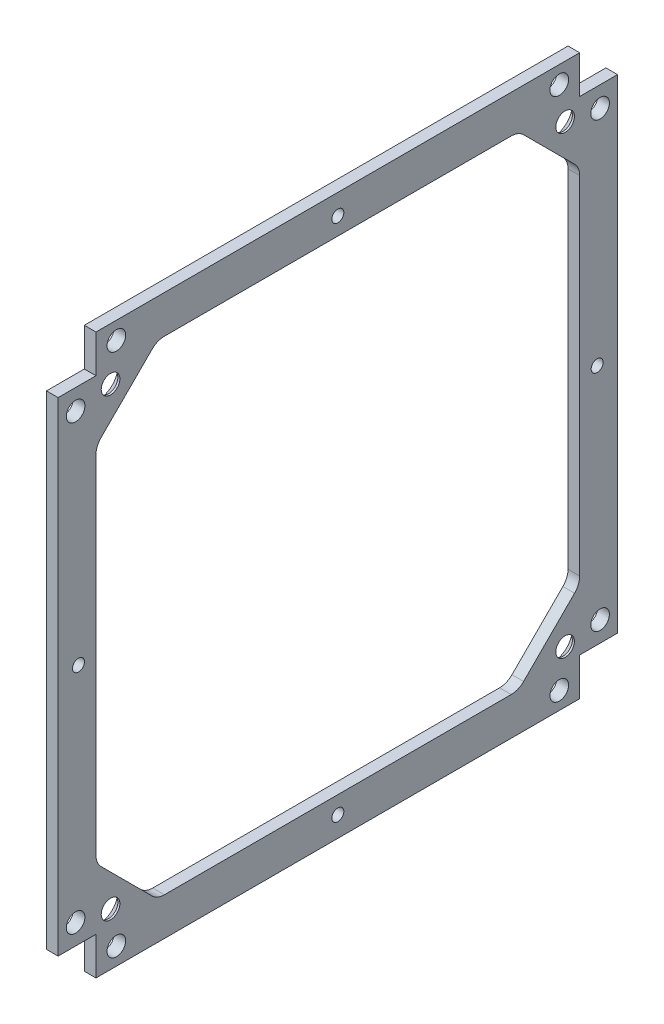
from build123d import *

# Parameters (mm, degrees)
BOSS_EXTRUDE2_DEPTH                          = 2
F_3_2_3_2_DIAMETER_HOLE1_D                   = 3.2
F_3_2_3_2_DIAMETER_HOLE2_D                   = 3.2
F_3_2_3_2_DIAMETER_HOLE3_D                   = 3.2
F_3_2_3_2_DIAMETER_HOLE5_D                   = 3.2
F_3_2_3_2_DIAMETER_HOLE5_DEPTH               = 10
F_3_2_3_2_DIAMETER_HOLE5_TIP                 = 0.96137699
CSK_FOR_M3_FLAT_COUNTERSUNK_HEAD_SCR_2_COUNT = 2
CSK_FOR_M3_FLAT_COUNTERSUNK_HEAD_SCR_2_PITCH = 78
CSK_FOR_M3_FLAT_COUNTERSUNK_HEAD_SCR_3_COUNT = 2
CSK_FOR_M3_FLAT_COUNTERSUNK_HEAD_SCR_3_PITCH = 110.308657865
FILLET1_R                                    = 3
M2_5X0_45_TAPPED_HOLE1_D                     = 2.05


with BuildPart() as part:
    # Sketch2 → Boss-Extrude2 (new body)
    with BuildSketch(Plane.ZY.offset(51.493641502)):
        Polygon((0.93465612, 3.45185693), (7.43465612, 3.45185693), (7.43465612, 86.45185693), (0.93465612, 86.45185693), (0.93465612, 92.95185693), (-82.06534388, 92.95185693), (-82.06534388, 86.45185693), (-88.56534388, 86.45185693), (-88.56534388, 3.45185693), (-82.06534388, 3.45185693), (-82.06534388, -3.04814307), (0.93465612, -3.04814307), align=None)
        Polygon((-71.56534388, 86.45185693), (-82.06534388, 75.95185693), (-82.06534388, 13.95185693), (-71.56534388, 3.45185693), (-9.56534388, 3.45185693), (0.93465612, 13.95185693), (0.93465612, 75.95185693), (-9.56534388, 86.45185693), align=None, mode=Mode.SUBTRACT)
    extrude(amount=BOSS_EXTRUDE2_DEPTH)

    # Sketch10 → CSK for M3 Flat Countersunk Head Screw3 (revolve, cut)
    with BuildSketch(Plane(origin=(-53.493641502, 5.95185693, -1.56534388), x_dir=(0, 0, 1), z_dir=(0, 1, 0))):
        Polygon((0, 0), (0, 2), (1.6, 2), (1.6, 1.65), (3.25, 0), align=None)
    revolve(axis=Axis((-59.843641502, 5.95185693, -1.56534388), (1, 0, 0)), mode=Mode.SUBTRACT)

    # Ø3.2 (3.2) Diameter Hole1 (through all)
    with Locations(Plane.ZY.offset(53.493641502)):
        with Locations((4.43465612, 6.95185693)):
            Hole(F_3_2_3_2_DIAMETER_HOLE1_D / 2)

    # Ø3.2 (3.2) Diameter Hole2 (through all)
    with Locations(Plane.ZY.offset(53.493641502)):
        with Locations((-2.56534388, -0.04814307)):
            Hole(F_3_2_3_2_DIAMETER_HOLE2_D / 2)

    # Ø3.2 (3.2) Diameter Hole3 (through all)
    with Locations(Plane.ZY.offset(53.493641502)):
        with Locations((-78.56534388, -0.04814307)):
            Hole(F_3_2_3_2_DIAMETER_HOLE3_D / 2)

    # Ø3.2 (3.2) Diameter Hole5
    with Locations(Plane(origin=(-53.493641502, 6.95185693, -85.56534388), x_dir=(0, 0, -1), z_dir=(-1, 0, 0))):
        with Locations((0, 0), (0, -76), (-7, -83), (-83, -83), (-90, -76)):
            Hole(F_3_2_3_2_DIAMETER_HOLE5_D / 2, depth=F_3_2_3_2_DIAMETER_HOLE5_DEPTH)
            with Locations((0, 0, -(F_3_2_3_2_DIAMETER_HOLE5_DEPTH + F_3_2_3_2_DIAMETER_HOLE5_TIP / 2))):  # 118° drill point
                Cone(0, F_3_2_3_2_DIAMETER_HOLE5_D / 2, F_3_2_3_2_DIAMETER_HOLE5_TIP, mode=Mode.SUBTRACT)

    # Sketch24 → CSK for M3 Flat Countersunk Head Screw5 (revolve, cut)
    with BuildSketch(Plane(origin=(-53.493641502, 5.95185693, -79.56534388), x_dir=(0, 0, 1), z_dir=(0, 1, 0))):
        Polygon((0, 0), (0, 2), (1.6, 2), (1.6, 1.65), (3.25, 0), align=None)
    csk_for_m3_flat_countersunk_head_screw5 = revolve(axis=Axis((-59.843641502, 5.95185693, -79.56534388), (1, 0, 0)), mode=Mode.SUBTRACT)

    # CSK for M3 Flat Countersunk Head Scr 2: CSK for M3 Flat Countersunk Head Screw5 ×2
    with Locations(*[(0, i * CSK_FOR_M3_FLAT_COUNTERSUNK_HEAD_SCR_2_PITCH, 0) for i in range(1, CSK_FOR_M3_FLAT_COUNTERSUNK_HEAD_SCR_2_COUNT)]):
        add(csk_for_m3_flat_countersunk_head_screw5, mode=Mode.SUBTRACT)

    # CSK for M3 Flat Countersunk Head Scr 3: CSK for M3 Flat Countersunk Head Screw5 ×2
    with Locations(*[Vector(0, 0.7071067811865477, 0.7071067811865474) * (i * CSK_FOR_M3_FLAT_COUNTERSUNK_HEAD_SCR_3_PITCH) for i in range(1, CSK_FOR_M3_FLAT_COUNTERSUNK_HEAD_SCR_3_COUNT)]):
        add(csk_for_m3_flat_countersunk_head_screw5, mode=Mode.SUBTRACT)

    # Fillet1
    fillet1_edges = [part.edges().sort_by_distance(p)[0] for p in [
        (-52.493641502, 86.45185693, -9.56534388),
        (-52.493641502, 86.45185693, -71.56534388),
        (-52.493641502, 75.95185693, -82.06534388),
        (-52.493641502, 13.95185693, -82.06534388),
        (-52.493641502, 3.45185693, -71.56534388),
        (-52.493641502, 3.45185693, -9.56534388),
        (-52.493641502, 13.95185693, 0.93465612),
        (-52.493641502, 75.95185693, 0.93465612),
    ]]
    fillet(fillet1_edges, radius=FILLET1_R)

    # M2.5x0.45 Tapped Hole1 (through all)
    with Locations(Plane(origin=(-53.493641502, 89.45185693, -40.56534388), x_dir=(0, 0, -1), z_dir=(-1, 0, 0))):
        with Locations((0, 0), (44.5, 44.5), (0, 89), (-44.5, 44.5)):
            Hole(M2_5X0_45_TAPPED_HOLE1_D / 2)


solid = part.part
